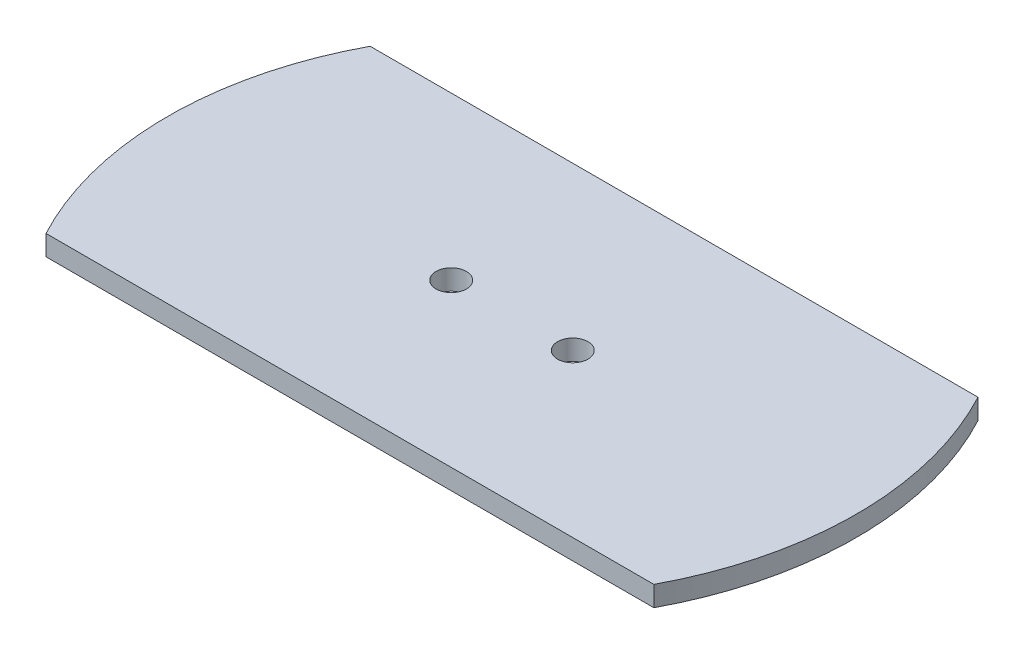
from build123d import *

# Parameters (mm, degrees)
BOSS_EXTRUDE1_DEPTH = 3.175
SKETCH2_R           = 2.38125
CUT_EXTRUDE1_DEPTH  = 3.175


with BuildPart() as part:
    # Sketch1 → Boss-Extrude1 (new body)
    with BuildSketch(Plane(origin=(0, 0, 0), x_dir=(1, 0, 0), z_dir=(0, 1, 0))):
        with BuildLine():
            Line((0, 0), (95.25, 0))
            ThreePointArc((95.25, 0), (101.6, -25.4), (95.25, -50.8))
            Line((95.25, -50.8), (0, -50.8))
            ThreePointArc((0, -50.8), (-6.35, -25.4), (0, 0))
        make_face()
    extrude(amount=BOSS_EXTRUDE1_DEPTH)

    # Sketch2 → Cut-Extrude1 (cut)
    with BuildSketch(Plane(origin=(0, 3.175, 0), x_dir=(1, 0, 0), z_dir=(0, 1, 0))):
        with Locations(Location((38.1, -25.4, 0), (0, 0, 270))):
            Circle(SKETCH2_R)
        with Locations(Location((57.15, -25.4, 0), (0, 0, 270))):
            Circle(SKETCH2_R)
    extrude(amount=-CUT_EXTRUDE1_DEPTH, mode=Mode.SUBTRACT)


solid = part.part
